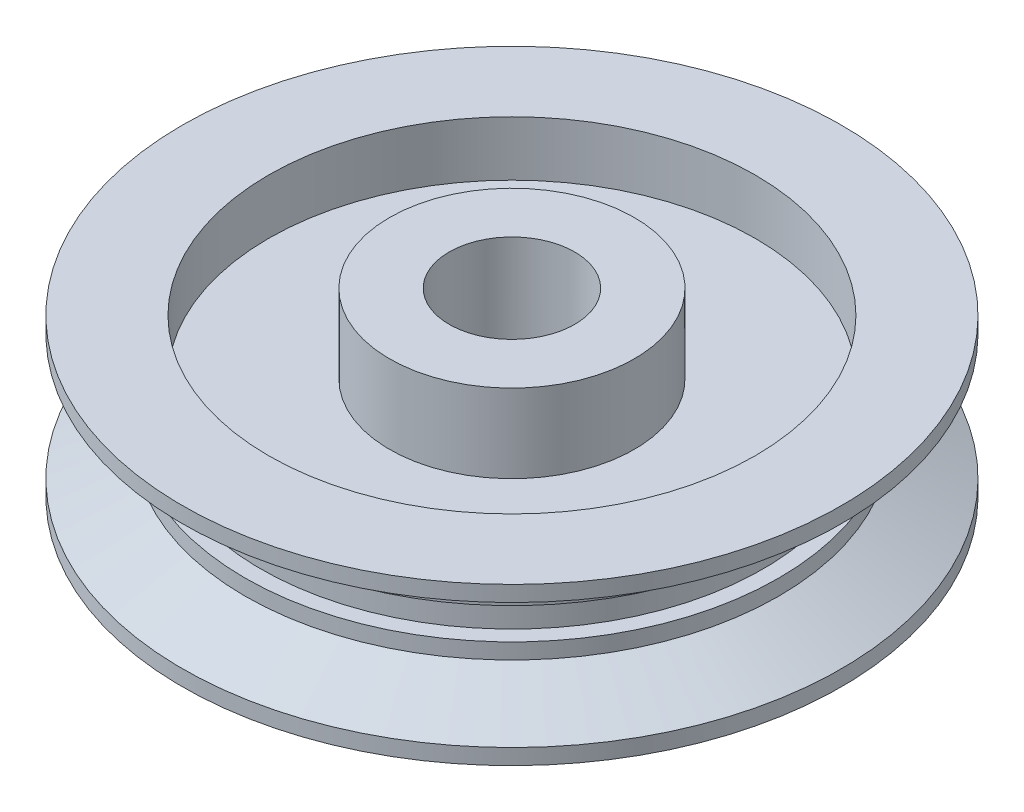
from build123d import *

# Parameters (mm, degrees)
SKETCH_2_R          = 7.75
CUT_EXTRUDE_1_DEPTH = 1.75
SKETCH_3_R          = 3.9
EXTRUDE_1_DEPTH     = 2.5
CUT_EXTRUDE_2_REACH = 18.21
SKETCH_4_R          = 2


with BuildPart() as part:
    # 草图1 → 旋转1 (revolve)
    with BuildSketch(Plane.XY):
        Polygon((0, 0), (-8, 0), (-8, 0.5), (-8.5, 0.5), (-8.5, 1), (-10.5, 2), (-10.5, 2.5), (0, 2.5), align=None)
    revolve_1 = revolve(axis=Axis((0, 2.5, 0), (0, -1, 0)))

    # 镜向1: 旋转1 across plane
    add(revolve_1.mirror(Plane.ZX))

    # 草图2 → 切除-拉伸1 (cut)
    with BuildSketch(Plane(origin=(0, 2.5, 0), x_dir=(1, 0, 0), z_dir=(0, 1, 0))):
        with Locations(Location((0, 0, 0), (0, 0, 180))):
            Circle(SKETCH_2_R)
    cut_extrude_1 = extrude(amount=-CUT_EXTRUDE_1_DEPTH, mode=Mode.SUBTRACT)

    # 草图3 → 凸台-拉伸1 (add)
    with BuildSketch(Plane(origin=(0, 0.75, 0), x_dir=(1, 0, 0), z_dir=(0, 1, 0))):
        with Locations(Location((0, 0, 0), (0, 0, 180))):
            Circle(SKETCH_3_R)
    extrude_1 = extrude(amount=EXTRUDE_1_DEPTH)

    # 镜向2: 切除-拉伸1, 凸台-拉伸1 across plane
    add(cut_extrude_1.mirror(Plane.ZX), mode=Mode.SUBTRACT)
    add(extrude_1.mirror(Plane.ZX))

    # 草图4 → 切除-拉伸2 (cut, up to next)
    with BuildSketch(Plane(origin=(0, 3.25, 0), x_dir=(1, 0, 0), z_dir=(0, 1, 0)), mode=Mode.PRIVATE) as cut_extrude_2_sk1:
        with Locations(Location((0, 0, 0), (0, 0, 180))):
            Circle(SKETCH_4_R)
    cut_extrude_2_tool1 = extrude(cut_extrude_2_sk1.sketch, amount=-CUT_EXTRUDE_2_REACH, mode=Mode.PRIVATE) & part.part
    add(cut_extrude_2_tool1.solids().sort_by_distance((0, 3.25, 0))[0], mode=Mode.SUBTRACT)


solid = part.part
